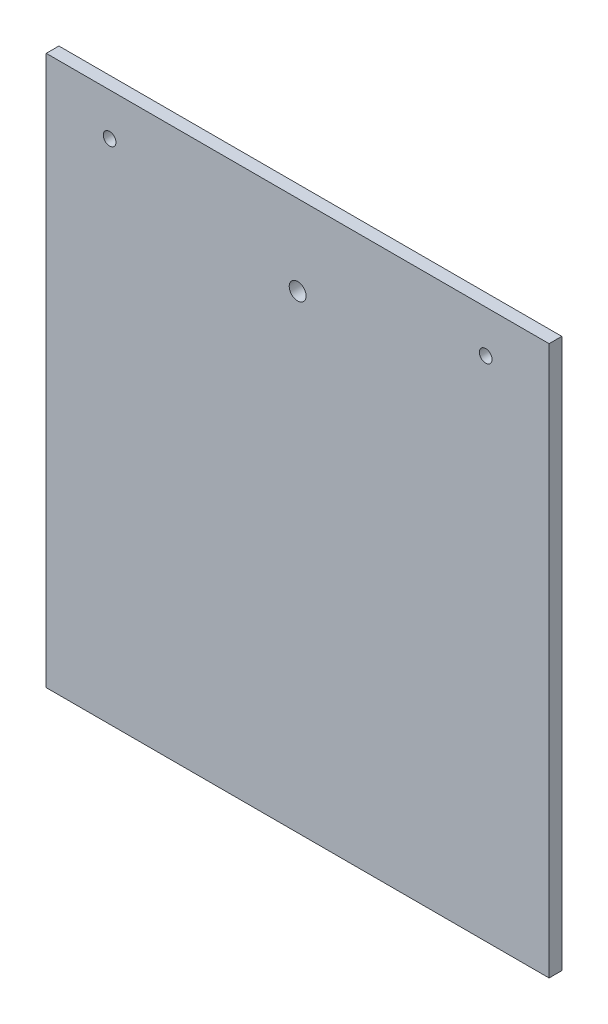
from build123d import *

# Parameters (mm, degrees)
SKETCH_1_W          = 119
SKETCH_1_H          = 130
EXTRUDE_1_DEPTH     = 3
SKETCH_2_R          = 1.5
CUT_EXTRUDE_1_DEPTH = 89.17170748
SKETCH_4_R          = 2
CUT_EXTRUDE_2_DEPTH = 89.17170748


with BuildPart() as part:
    # 草图1 → 凸台-拉伸1 (new body)
    with BuildSketch(Plane.XY):
        Rectangle(SKETCH_1_W, SKETCH_1_H)
    extrude(amount=EXTRUDE_1_DEPTH)

    # 草图2 → 切除-拉伸1 (cut, through all)
    with BuildSketch(Plane.XY.offset(3)):
        with Locations((44.5, 55)):
            Circle(SKETCH_2_R)
        with Locations(Location((-44.5, 55, 0), (0, 0, 180))):
            Circle(SKETCH_2_R)
    extrude(amount=-CUT_EXTRUDE_1_DEPTH, mode=Mode.SUBTRACT)

    # 草图4 → 切除-拉伸2 (cut, through all)
    with BuildSketch(Plane.XY.offset(3)):
        with Locations((0, 46)):
            Circle(SKETCH_4_R)
    extrude(amount=-CUT_EXTRUDE_2_DEPTH, mode=Mode.SUBTRACT)


solid = part.part
